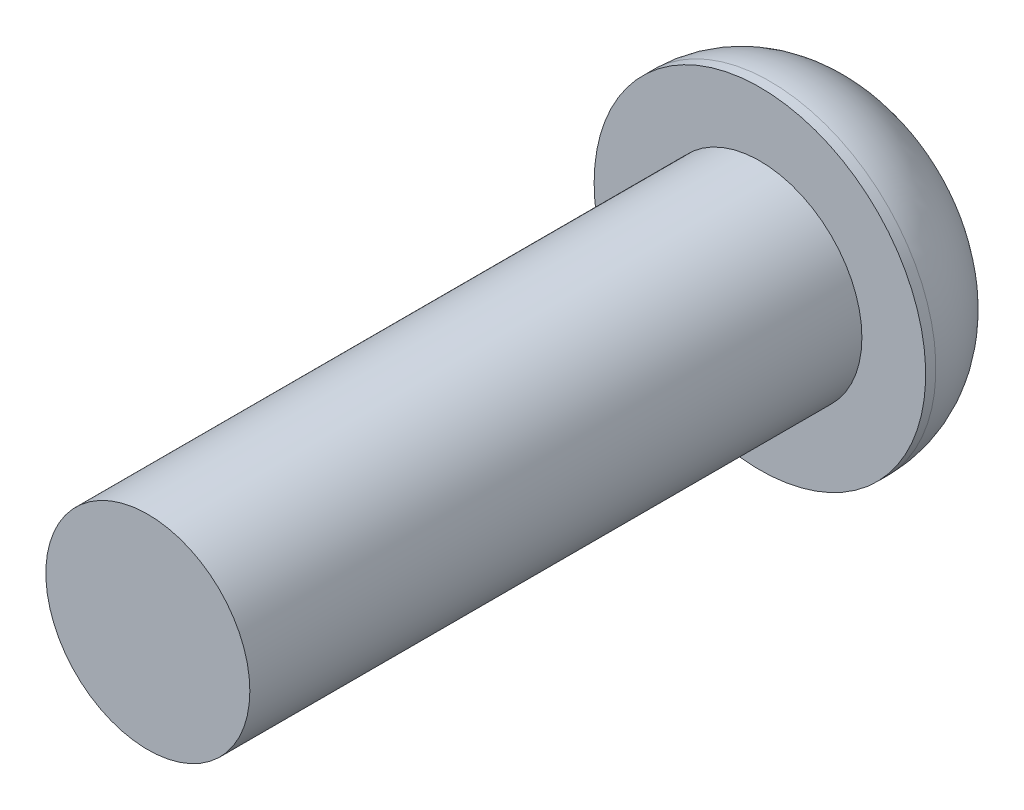
from build123d import *

# Parameters (mm, degrees)
SKETCH_1_R          = 2
EXTRUDE_1_DEPTH     = 12
SKETCH_2_R          = 3.25
EXTRUDE_2_DEPTH     = 2.2
FILLET_1_R          = 2
CUT_EXTRUDE_1_DEPTH = 0.5


with BuildPart() as part:
    # 草图1 → 凸台-拉伸1 (new body)
    with BuildSketch(Plane.XY):
        Circle(SKETCH_1_R)
    extrude(amount=EXTRUDE_1_DEPTH)

    # 草图2 → 凸台-拉伸2 (add)
    with BuildSketch(Plane(origin=(0, 0, 0), x_dir=(-1, 0, 0), z_dir=(0, 0, -1))):
        Circle(SKETCH_2_R)
    extrude(amount=EXTRUDE_2_DEPTH)

    # 圆角1
    fillet_1_edges = [part.edges().sort_by_distance(p)[0] for p in [
        (3.25, 0, -2.2),
    ]]
    fillet(fillet_1_edges, radius=FILLET_1_R)

    # 草图3 → 切除-拉伸1 (cut)
    with BuildSketch(Plane(origin=(0, 0, -2.2), x_dir=(-1, 0, 0), z_dir=(0, 0, -1))):
        Polygon((3.239974874, 0.25), (3.239974874, -0.25), (0.25, -0.25), (0.25, -3.239974874), (-0.25, -3.239974874), (-0.25, -0.25), (-3.239974874, -0.25), (-3.239974874, 0.25), (-0.25, 0.25), (-0.25, 3.239974874), (0.25, 3.239974874), (0.25, 0.25), align=None)
    extrude(amount=-CUT_EXTRUDE_1_DEPTH, mode=Mode.SUBTRACT)


solid = part.part
